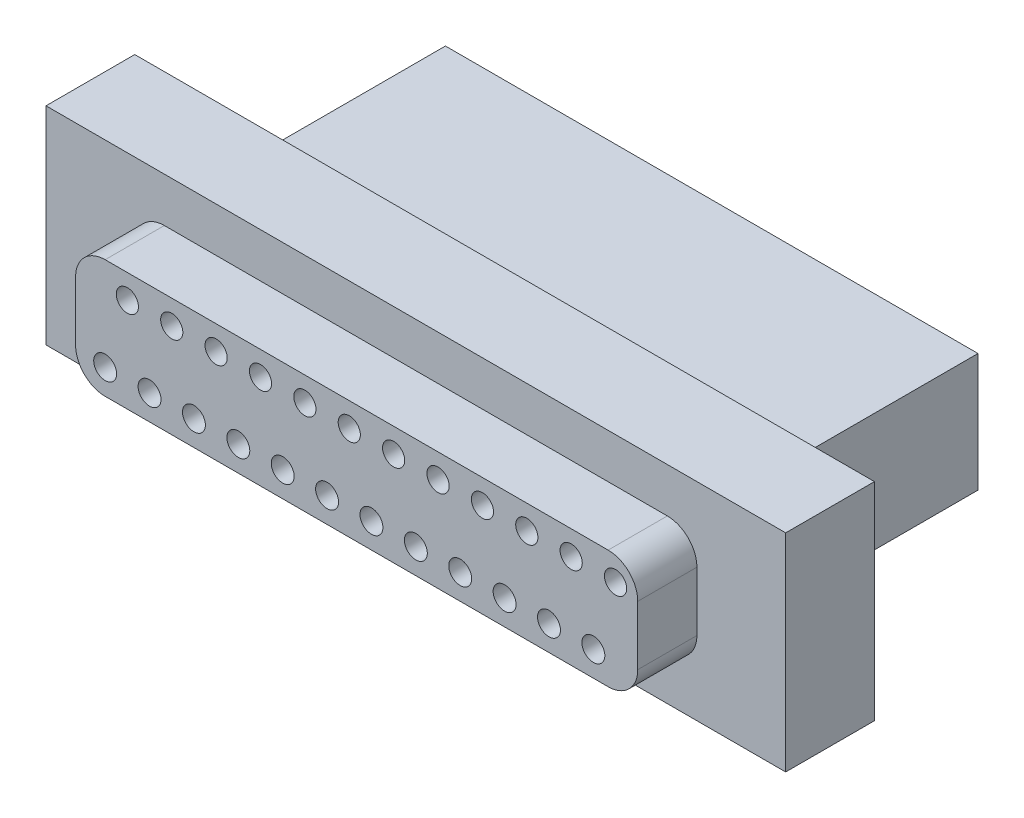
from build123d import *

# Parameters (mm, degrees)
SKETCH1_W           = 50
SKETCH1_H           = 20
BOSS_EXTRUDE1_DEPTH = 14
SKETCH2_W           = 50
SKETCH2_H           = 3
CUT_EXTRUDE1_DEPTH  = 14
SKETCH3_W           = 7
SKETCH3_H           = 8
CUT_EXTRUDE2_DEPTH  = 14
SKETCH4_W           = 38
SKETCH4_H           = 8
BOSS_EXTRUDE2_DEPTH = 4
FILLET2_R           = 2
SKETCH5_R           = 0.75
SKETCH5_R_2         = 0.775
CUT_EXTRUDE3_DEPTH  = 10


with BuildPart() as part:
    # Sketch1 → Boss-Extrude1 (new body)
    with BuildSketch(Plane(origin=(0, 0, 0), x_dir=(1, 0, 0), z_dir=(0, 1, 0))):
        with Locations((25, 10)):
            Rectangle(SKETCH1_W, SKETCH1_H)
    extrude(amount=BOSS_EXTRUDE1_DEPTH)

    # Sketch2 → Cut-Extrude1 (cut)
    with BuildSketch(Plane(origin=(0, 0, -20), x_dir=(-1, 0, 0), z_dir=(0, 0, -1))):
        with Locations((-25, 12.5)):
            Rectangle(SKETCH2_W, SKETCH2_H)
        with Locations((-25, 1.5)):
            Rectangle(SKETCH2_W, SKETCH2_H)
    extrude(amount=-CUT_EXTRUDE1_DEPTH, mode=Mode.SUBTRACT)

    # Sketch3 → Cut-Extrude2 (cut)
    with BuildSketch(Plane(origin=(0, 0, -20), x_dir=(-1, 0, 0), z_dir=(0, 0, -1))):
        with Locations((-3.5, 7)):
            Rectangle(SKETCH3_W, SKETCH3_H)
        with Locations((-46.5, 7)):
            Rectangle(SKETCH3_W, SKETCH3_H)
    extrude(amount=-CUT_EXTRUDE2_DEPTH, mode=Mode.SUBTRACT)

    # Sketch4 → Boss-Extrude2 (add)
    with BuildSketch(Plane.XY):
        with Locations((25, 6.990304204)):
            Rectangle(SKETCH4_W, SKETCH4_H)
    extrude(amount=BOSS_EXTRUDE2_DEPTH)

    # Fillet2
    fillet2_edges = [part.edges().sort_by_distance(p)[0] for p in [
        (44, 2.990304204, 2),
        (44, 10.990304204, 2),
        (6, 10.990304204, 2),
        (6, 2.990304204, 2),
    ]]
    fillet(fillet2_edges, radius=FILLET2_R)

    # Sketch5 → Cut-Extrude3 (cut)
    with BuildSketch(Plane.XY.offset(4)):
        with Locations((42.5, 9.355857952)):
            Circle(SKETCH5_R)
        with Locations((41, 4.690304204)):
            Circle(SKETCH5_R_2)
        with Locations((38, 4.690304204)):
            Circle(SKETCH5_R_2)
        with Locations((39.5, 9.355857952)):
            Circle(SKETCH5_R)
        with Locations((35, 4.690304204)):
            Circle(SKETCH5_R_2)
        with Locations((36.5, 9.355857952)):
            Circle(SKETCH5_R)
        with Locations((32, 4.690304204)):
            Circle(SKETCH5_R_2)
        with Locations((33.5, 9.355857952)):
            Circle(SKETCH5_R)
        with Locations((29, 4.690304204)):
            Circle(SKETCH5_R_2)
        with Locations((30.5, 9.355857952)):
            Circle(SKETCH5_R)
        with Locations((26, 4.690304204)):
            Circle(SKETCH5_R_2)
        with Locations((27.5, 9.355857952)):
            Circle(SKETCH5_R)
        with Locations((23, 4.690304204)):
            Circle(SKETCH5_R_2)
        with Locations((24.5, 9.355857952)):
            Circle(SKETCH5_R)
        with Locations((20, 4.690304204)):
            Circle(SKETCH5_R_2)
        with Locations((21.5, 9.355857952)):
            Circle(SKETCH5_R)
        with Locations((17, 4.690304204)):
            Circle(SKETCH5_R_2)
        with Locations((18.5, 9.355857952)):
            Circle(SKETCH5_R)
        with Locations((14, 4.690304204)):
            Circle(SKETCH5_R_2)
        with Locations((15.5, 9.355857952)):
            Circle(SKETCH5_R)
        with Locations((11, 4.690304204)):
            Circle(SKETCH5_R_2)
        with Locations((12.5, 9.355857952)):
            Circle(SKETCH5_R)
        with Locations((8, 4.690304204)):
            Circle(SKETCH5_R_2)
        with Locations((9.5, 9.355857952)):
            Circle(SKETCH5_R)
    extrude(amount=-CUT_EXTRUDE3_DEPTH, mode=Mode.SUBTRACT)


solid = part.part
